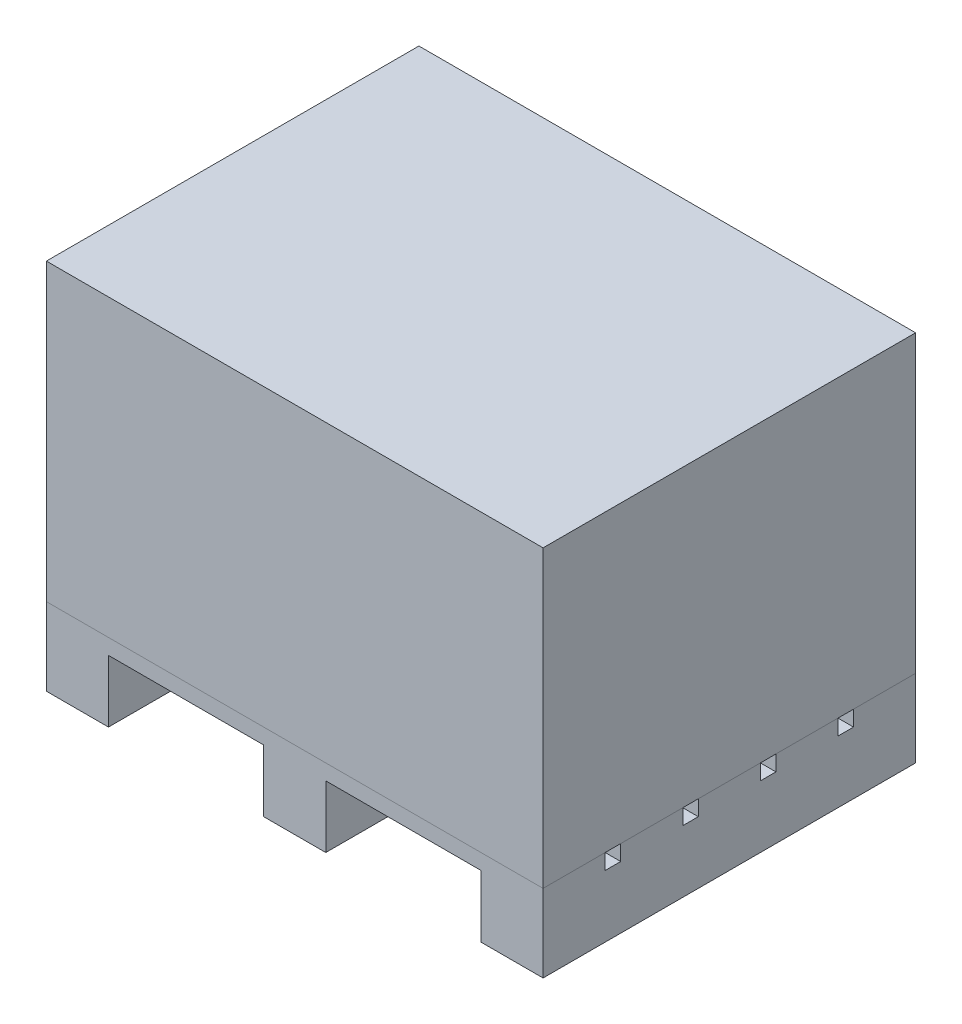
from build123d import *

# Parameters (mm, degrees)
CROQUIS1_W                = 10
CROQUIS1_H                = 60
SALIENTE_EXTRUIR1_DEPTH   = 10
SALIENTE_EXTRUIR1_2_DEPTH = 10
SALIENTE_EXTRUIR1_3_DEPTH = 10
CROQUIS2_W                = 80
CROQUIS2_H                = 10
SALIENTE_EXTRUIR2_DEPTH   = 2.5
CROQUIS3_W                = 80
CROQUIS3_H                = 60
SALIENTE_EXTRUIR5_DEPTH   = 47.5


with BuildPart() as part:
    # Croquis1 → Saliente-Extruir1 (new body)
    with BuildSketch(Plane(origin=(0, 0, 0), x_dir=(1, 0, 0), z_dir=(0, 1, 0))):
        with Locations((-51.849391859, -8.068789191)):
            Rectangle(CROQUIS1_W, CROQUIS1_H)
    extrude(amount=SALIENTE_EXTRUIR1_DEPTH)



with BuildPart() as body_2:
    # Croquis1 → Saliente-Extruir1 2 (new body)
    with BuildSketch(Plane(origin=(0, 0, 0), x_dir=(1, 0, 0), z_dir=(0, 1, 0))):
        with Locations((-16.849391859, -8.068789191)):
            Rectangle(CROQUIS1_W, CROQUIS1_H)
    extrude(amount=SALIENTE_EXTRUIR1_2_DEPTH)


with BuildPart() as body_3:
    # Croquis1 → Saliente-Extruir1 3 (new body)
    with BuildSketch(Plane(origin=(0, 0, 0), x_dir=(1, 0, 0), z_dir=(0, 1, 0))):
        with Locations((18.150608141, -8.068789191)):
            Rectangle(CROQUIS1_W, CROQUIS1_H)
    extrude(amount=SALIENTE_EXTRUIR1_3_DEPTH)


with BuildPart() as part_1:
    add(part.part)

    add(body_2.part)  # Saliente-Extruir2 merges body 2

    add(body_3.part)  # Saliente-Extruir2 merges body 3
    # Croquis2 → Saliente-Extruir2 (add)
    with BuildSketch(Plane(origin=(0, 10, 0), x_dir=(1, 0, 0), z_dir=(0, 1, 0))):
        with Locations((-16.849391859, -33.068789191)):
            Rectangle(CROQUIS2_W, CROQUIS2_H)
        with Locations((-16.849391859, 16.931210809)):
            Rectangle(CROQUIS2_W, CROQUIS2_H)
        with Locations((-16.849391859, 4.431210809)):
            Rectangle(CROQUIS2_W, CROQUIS2_H)
        with Locations((-16.849391859, -20.568789191)):
            Rectangle(CROQUIS2_W, CROQUIS2_H)
        with Locations((-16.849391859, -8.068789191)):
            Rectangle(CROQUIS2_W, CROQUIS2_H)
    extrude(amount=SALIENTE_EXTRUIR2_DEPTH)


with BuildPart() as body_2_2:
    # Croquis3 → Saliente-Extruir5 (new body)
    with BuildSketch(Plane(origin=(0, 12.5, 0), x_dir=(1, 0, 0), z_dir=(0, 1, 0))):
        with Locations((-16.849391859, -8.068789191)):
            Rectangle(CROQUIS3_W, CROQUIS3_H)
    extrude(amount=SALIENTE_EXTRUIR5_DEPTH)


solid = Compound([part_1.part, body_2_2.part])
